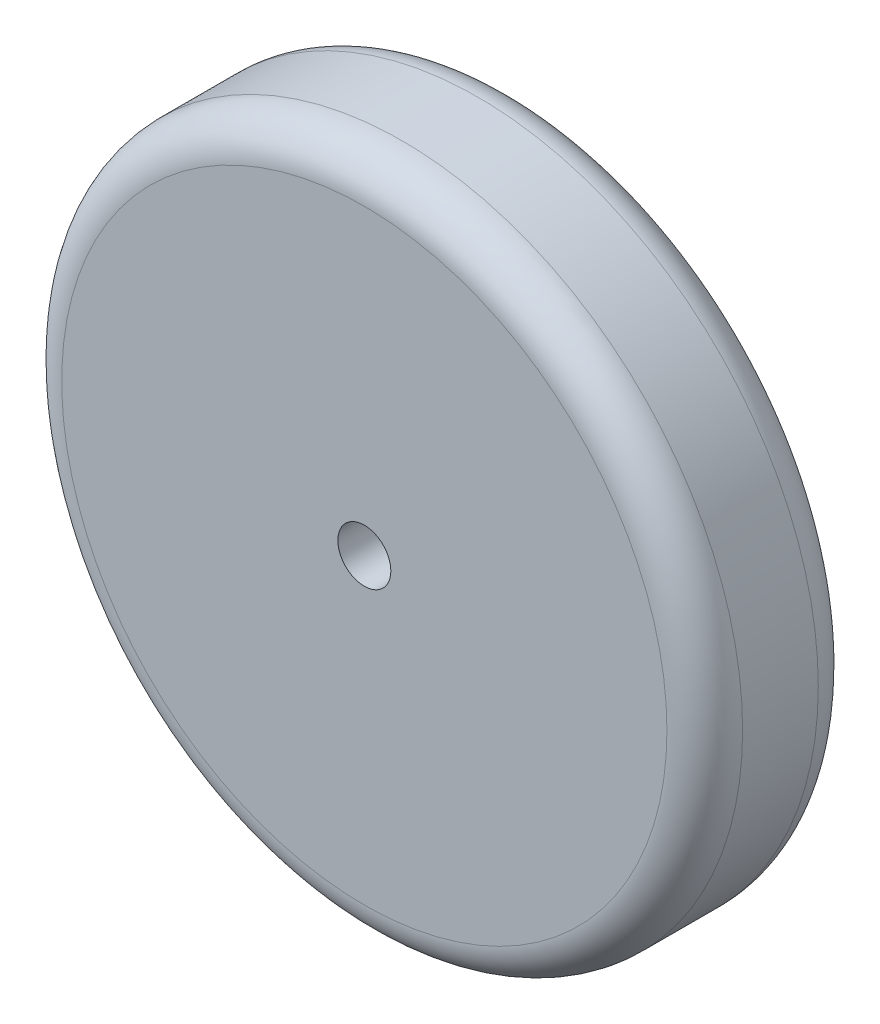
from build123d import *

# Parameters (mm, degrees)
SKETCH1_R           = 45
SKETCH1_R_2         = 42.5
SKETCH1_R_3         = 3.5
BOSS_EXTRUDE1_DEPTH = 20
FILLET1_R           = 5
FILLET2_R           = 5
CUT_EXTRUDE2_DEPTH  = 6


with BuildPart() as part:
    # Sketch1 → Boss-Extrude1 (new body)
    # profile 1 of 2: a face of its own
    with BuildSketch(Plane.XY):
        Circle(SKETCH1_R)
        Circle(SKETCH1_R_2, mode=Mode.SUBTRACT)
    # profile 2 of 2: a face of its own
    with BuildSketch(Plane.XY):
        Circle(SKETCH1_R_2)
        Circle(SKETCH1_R_3, mode=Mode.SUBTRACT)
    extrude(amount=BOSS_EXTRUDE1_DEPTH)

    # Fillet1
    fillet1_edges = [part.edges().sort_by_distance(p)[0] for p in [
        (-45, 0, 0),
    ]]
    fillet(fillet1_edges, radius=FILLET1_R)

    # Fillet2
    fillet2_edges = [part.edges().sort_by_distance(p)[0] for p in [
        (-45, 0, 20),
    ]]
    fillet(fillet2_edges, radius=FILLET2_R)

    # Sketch2 → Cut-Extrude2 (cut)
    with BuildSketch(Plane(origin=(0, 0, 0), x_dir=(-1, 0, 0), z_dir=(0, 0, -1))):
        with BuildLine():
            Line((38.042260652, 12.360679775), (4.755282581, 1.545084972))
            ThreePointArc((4.755282581, 1.545084972), (4.938441703, 0.782172325), (5, 0))
            ThreePointArc((5, 0), (4.999202336, -0.08930847), (4.996809599, -0.178588445))
            Line((4.996809599, -0.178588445), (39.974476791, -1.42870756))
            Line((39.974476791, -1.42870756), (38.042260652, 12.360679775))
        make_face()
        with BuildLine():
            Line((38.042260652, -12.360679775), (4.755282581, -1.545084972))
            ThreePointArc((4.755282581, -1.545084972), (4.4137767, -2.349164796), (3.937532229, -3.081532078))
            Line((3.937532229, -3.081532078), (31.500257831, -24.652256622))
            Line((31.500257831, -24.652256622), (38.042260652, -12.360679775))
        make_face()
        with BuildLine():
            Line((23.511410092, -32.360679775), (2.938926261, -4.045084972))
            ThreePointArc((2.938926261, -4.045084972), (2.190015937, -4.494867094), (1.374251379, -4.807435194))
            Line((1.374251379, -4.807435194), (10.994011035, -38.459481554))
            Line((10.994011035, -38.459481554), (23.511410092, -32.360679775))
        make_face()
        with BuildLine():
            ThreePointArc((0, -5), (-0.870256478, -4.923682937), (-1.713946788, -4.697061465))
            Line((-1.713946788, -4.697061465), (-13.711574304, -37.576491721))
            Line((-13.711574304, -37.576491721), (0, -40))
            Line((0, -40), (0, -5))
        make_face()
        with BuildLine():
            ThreePointArc((-2.938926261, -4.045084972), (-3.598120497, -3.471819248), (-4.147475537, -2.792569904))
            Line((-4.147475537, -2.792569904), (-33.179804299, -22.34055923))
            Line((-33.179804299, -22.34055923), (-23.511410092, -32.360679775))
            Line((-23.511410092, -32.360679775), (-2.938926261, -4.045084972))
        make_face()
        with BuildLine():
            ThreePointArc((-4.755282581, -1.545084972), (-4.951624782, -0.693838608), (-4.996809599, 0.178588445))
            Line((-4.996809599, 0.178588445), (-39.974476791, 1.42870756))
            Line((-39.974476791, 1.42870756), (-38.042260652, -12.360679775))
            Line((-38.042260652, -12.360679775), (-4.755282581, -1.545084972))
        make_face()
        with BuildLine():
            ThreePointArc((-4.755282581, 1.545084972), (-4.4137767, 2.349164796), (-3.937532229, 3.081532078))
            Line((-3.937532229, 3.081532078), (-31.500257831, 24.652256622))
            Line((-31.500257831, 24.652256622), (-38.042260652, 12.360679775))
            Line((-38.042260652, 12.360679775), (-4.755282581, 1.545084972))
        make_face()
        with BuildLine():
            ThreePointArc((-2.938926261, 4.045084972), (-2.190015937, 4.494867094), (-1.374251379, 4.807435194))
            Line((-1.374251379, 4.807435194), (-10.994011035, 38.459481554))
            Line((-10.994011035, 38.459481554), (-23.511410092, 32.360679775))
            Line((-23.511410092, 32.360679775), (-2.938926261, 4.045084972))
        make_face()
        with BuildLine():
            Line((23.511410092, 32.360679775), (2.938926261, 4.045084972))
            ThreePointArc((2.938926261, 4.045084972), (3.598120497, 3.471819248), (4.147475537, 2.792569904))
            Line((4.147475537, 2.792569904), (33.179804299, 22.34055923))
            Line((33.179804299, 22.34055923), (23.511410092, 32.360679775))
        make_face()
        Polygon((13.711574304, 37.576491721), (1.713946788, 4.697061465), (0, 5), (0, 40), align=None)
    extrude(amount=-CUT_EXTRUDE2_DEPTH, mode=Mode.SUBTRACT)


solid = part.part
